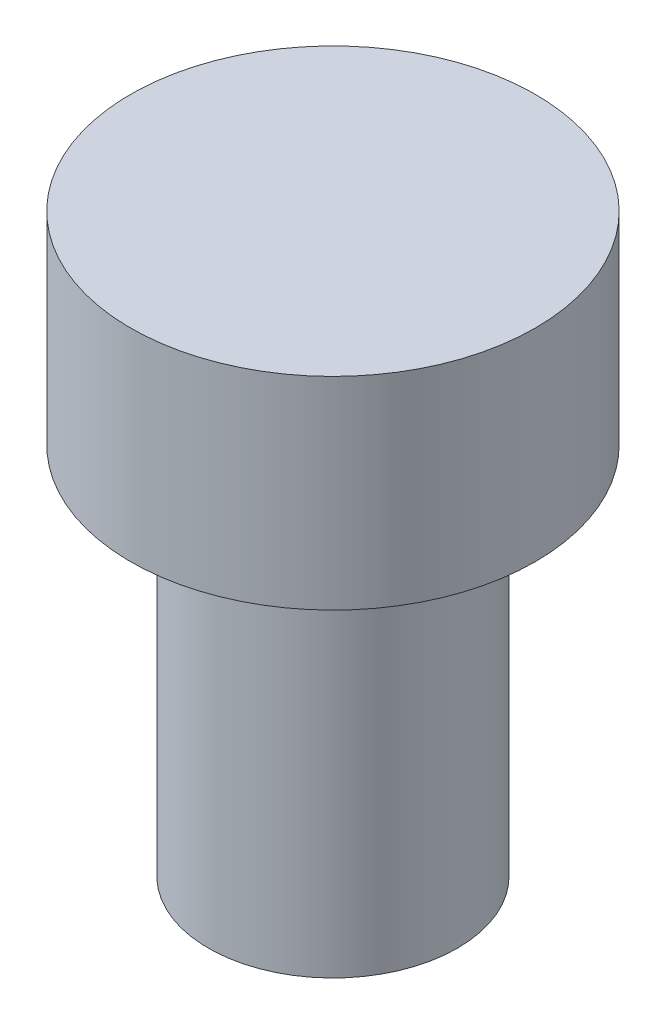
from build123d import *

# Parameters (mm, degrees)
EXTRUDE_START          = -60
EXTRUDE_SKETCH_1_R     = 16
EXTRUDE_1_DEPTH        = 48
EXTRUDE_ROTATE_1_ANGLE = 90
EXTRUDE_START_2        = -12
EXTRUDE_SKETCH_2_R     = 26
EXTRUDE_2_DEPTH        = 26
EXTRUDE_ROTATE_2_ANGLE = 90


with BuildPart() as part:
    # Extrude sketch 1 → Extrude 1 (new body)
    with BuildSketch(Plane.XY.offset(EXTRUDE_START)):
        Circle(EXTRUDE_SKETCH_1_R)
    extrude(amount=EXTRUDE_1_DEPTH)


with BuildPart() as part_1:
    # Extrude rotate 1: moved
    add(part.part.rotate(Axis((0, 0, 0), (-1, 0, 0)), EXTRUDE_ROTATE_1_ANGLE))


with BuildPart() as part_2:
    # Extrude place 1: moved
    add(part_1.part.moved(Location((757.5, 0, 515))))


with BuildPart() as body_2:
    # Extrude sketch 2 → Extrude 2 (new body)
    with BuildSketch(Plane.XY.offset(EXTRUDE_START_2)):
        Circle(EXTRUDE_SKETCH_2_R)
    extrude(amount=EXTRUDE_2_DEPTH)


with BuildPart() as body_2_1:
    # Extrude rotate 2: moved
    add(body_2.part.rotate(Axis((0, 0, 0), (-1, 0, 0)), EXTRUDE_ROTATE_2_ANGLE))


with BuildPart() as body_2_2:
    # Extrude place 2: moved
    add(body_2_1.part.moved(Location((757.5, 0, 515))))


with BuildPart() as part_3:
    add(part_2.part)

    # Combine (weld / assembly of features): union body 2
    add(body_2_2.part)


solid = part_3.part
